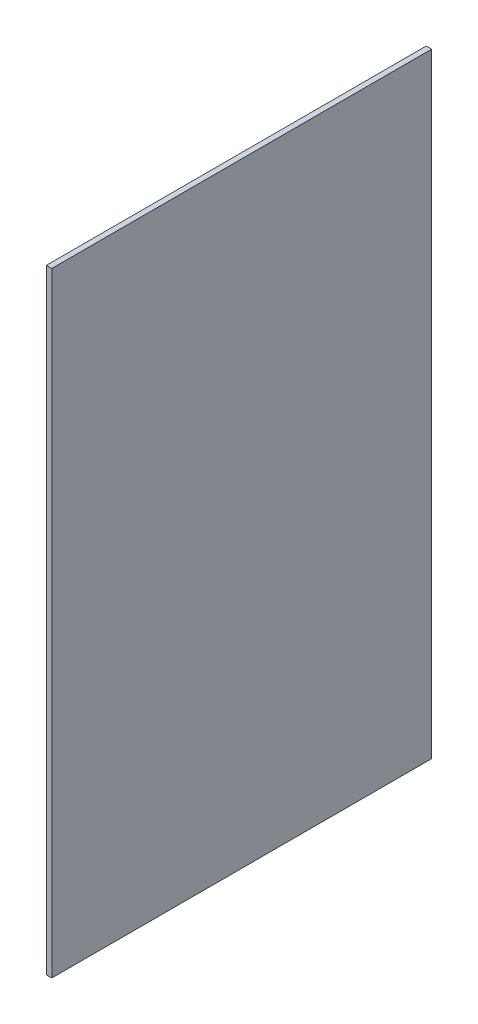
from build123d import *

# Parameters (mm, degrees)
CROQUIS1_W              = 3.3
CROQUIS1_H              = 372
SALIENTE_EXTRUIR2_DEPTH = 230


with BuildPart() as part:
    # Croquis1 → Saliente-Extruir2 (new body)
    with BuildSketch(Plane.XY):
        with Locations((451.65, 267.3)):
            Rectangle(CROQUIS1_W, CROQUIS1_H)
    extrude(amount=SALIENTE_EXTRUIR2_DEPTH)


solid = part.part
